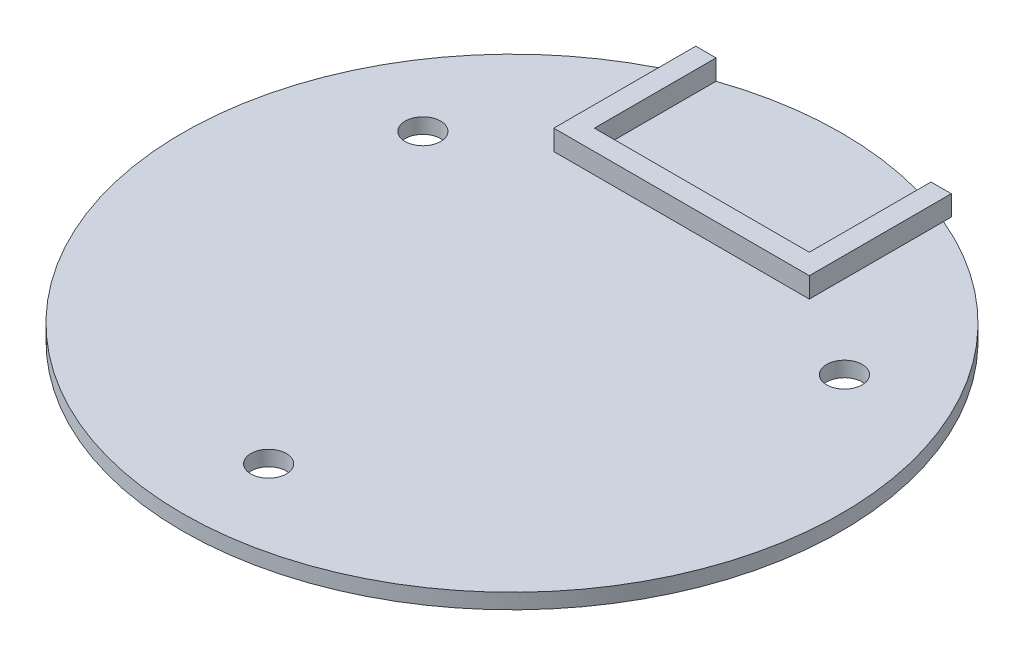
from build123d import *

# Parameters (mm, degrees)
SKETCH_1_R               = 32.5
EXTRUDE_1_DEPTH          = 1.5
EXTRUDE_4_DEPTH          = 2
SKETCH_2_R               = 1.75
CUT_EXTRUDE_1_DEPTH      = 7
PATTERN_CIRCULAR_1_COUNT = 3


with BuildPart() as part:
    # 草图1 → 凸台-拉伸1 (new body)
    with BuildSketch(Plane(origin=(0, 0, 0), x_dir=(1, 0, 0), z_dir=(0, 1, 0))):
        with Locations(Location((0, 0, 0), (0, 0, 270))):
            Circle(SKETCH_1_R)
    extrude(amount=EXTRUDE_1_DEPTH)

    # 草图4 → 凸台-拉伸4 (add)
    with BuildSketch(Plane(origin=(0, 1.5, 0), x_dir=(1, 0, 0), z_dir=(0, 1, 0))):
        Polygon((-12.6, 30.722792842), (-12.6, 16.722792842), (12.6, 16.722792842), (12.6, 30.722792842), (10.6, 30.722792842), (10.6, 18.722792842), (-10.6, 18.722792842), (-10.6, 30.722792842), align=None)
    extrude(amount=EXTRUDE_4_DEPTH)

    # 草图2 → 切除-拉伸1 (cut)
    with BuildSketch(Plane.XZ):
        with Locations(Location((0, 24, 0), (0, 0, 270))):
            Circle(SKETCH_2_R)
    cut_extrude_1 = extrude(amount=-CUT_EXTRUDE_1_DEPTH, mode=Mode.SUBTRACT)

    # 阵列(圆周)1: 切除-拉伸1 ×3 about axis
    pattern_circular_1_axis = Axis((0, 0, 0), (0, 1, 0))
    for i in range(1, PATTERN_CIRCULAR_1_COUNT):
        add(cut_extrude_1.rotate(pattern_circular_1_axis, i * 360 / PATTERN_CIRCULAR_1_COUNT), mode=Mode.SUBTRACT)


solid = part.part
